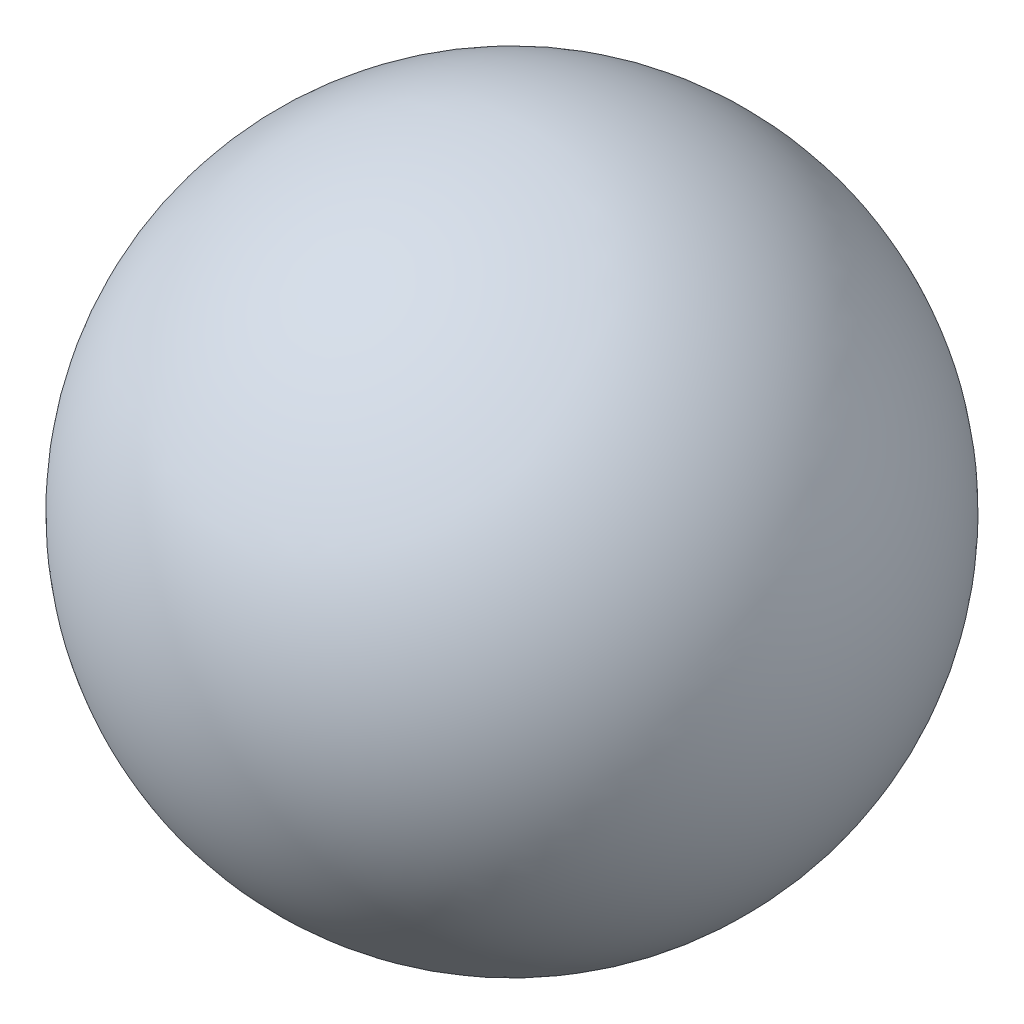
from build123d import *


with BuildPart() as part:
    # Sketch2 → Revolve-Thin4 (revolve)
    with BuildSketch(Plane(origin=(0, 0, 0), x_dir=(1, 0, 0), z_dir=(0, 1, 0))):
        with BuildLine():
            ThreePointArc((0, 25.4), (-25.4, 0), (0, -25.4))
            Line((0, -25.4), (0, -26.4))
            ThreePointArc((0, -26.4), (-26.4, 0), (0, 26.4))
            Line((0, 26.4), (0, 25.4))
        make_face()
    revolve(axis=Axis((0, 0, -43.481035393), (0, 0, 1)))


solid = part.part
